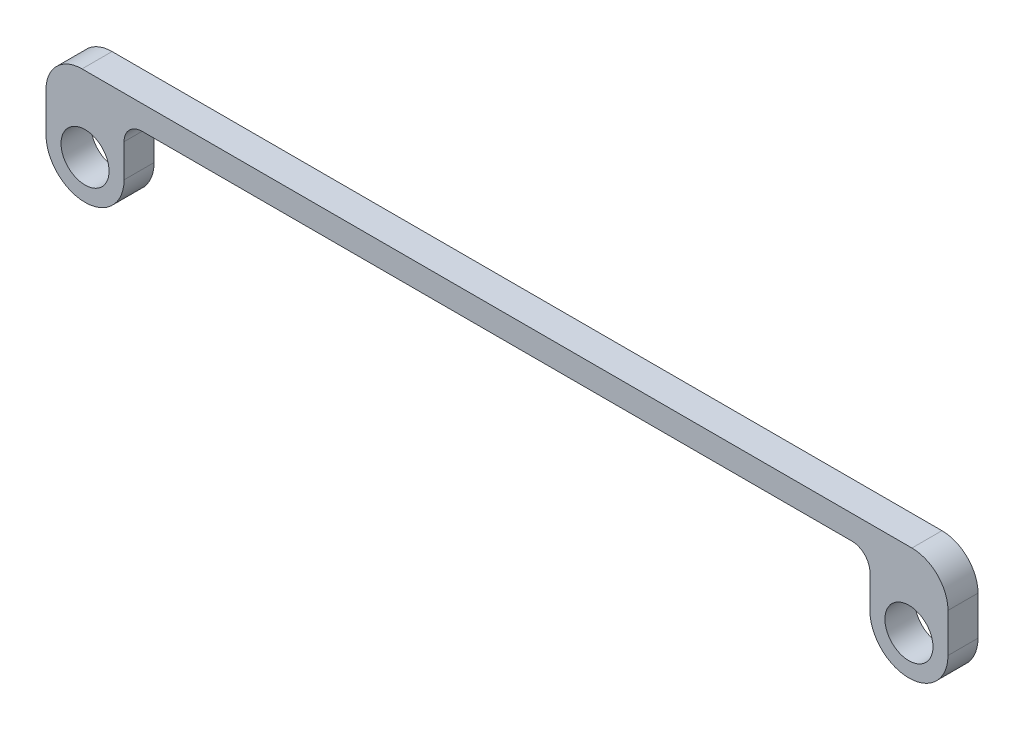
from build123d import *

# Parameters (mm, degrees)
BOSS_EXTRUDE1_DEPTH = 5
SKETCH2_R           = 4
CUT_EXTRUDE1_DEPTH  = 152.449757015
FILLET1_R           = 6
FILLET2_R           = 3


with BuildPart() as part:
    # Sketch1 → Boss-Extrude1 (new body)
    with BuildSketch(Plane.XY):
        with BuildLine():
            Line((0, 0), (130.17, 0))
            Line((130.17, 0), (150.17, 0))
            Line((150.17, 0), (150.17, -4))
            Line((150.17, -4), (150.17, -12.5))
            ThreePointArc((150.17, -12.5), (143.67, -19), (137.17, -12.5))
            Line((137.17, -12.5), (137.17, -4))
            Line((137.17, -4), (13, -4))
            Line((13, -4), (13, -12.5))
            ThreePointArc((13, -12.5), (6.5, -19), (0, -12.5))
            Line((0, -12.5), (0, -4))
            Line((0, -4), (0, 0))
        make_face()
    extrude(amount=BOSS_EXTRUDE1_DEPTH)

    # Sketch2 → Cut-Extrude1 (cut, through all)
    with BuildSketch(Plane.XY.offset(5)):
        with Locations((6.5, -12.5)):
            Circle(SKETCH2_R)
        with Locations((143.67, -12.5)):
            Circle(SKETCH2_R)
    extrude(amount=-CUT_EXTRUDE1_DEPTH, mode=Mode.SUBTRACT)

    # Fillet1
    fillet1_edges = [part.edges().sort_by_distance(p)[0] for p in [
        (0, 0, 2.5),
        (150.17, 0, 2.5),
    ]]
    fillet(fillet1_edges, radius=FILLET1_R)

    # Fillet2
    fillet2_edges = [part.edges().sort_by_distance(p)[0] for p in [
        (137.17, -4, 2.5),
        (13, -4, 2.5),
    ]]
    fillet(fillet2_edges, radius=FILLET2_R)


solid = part.part
